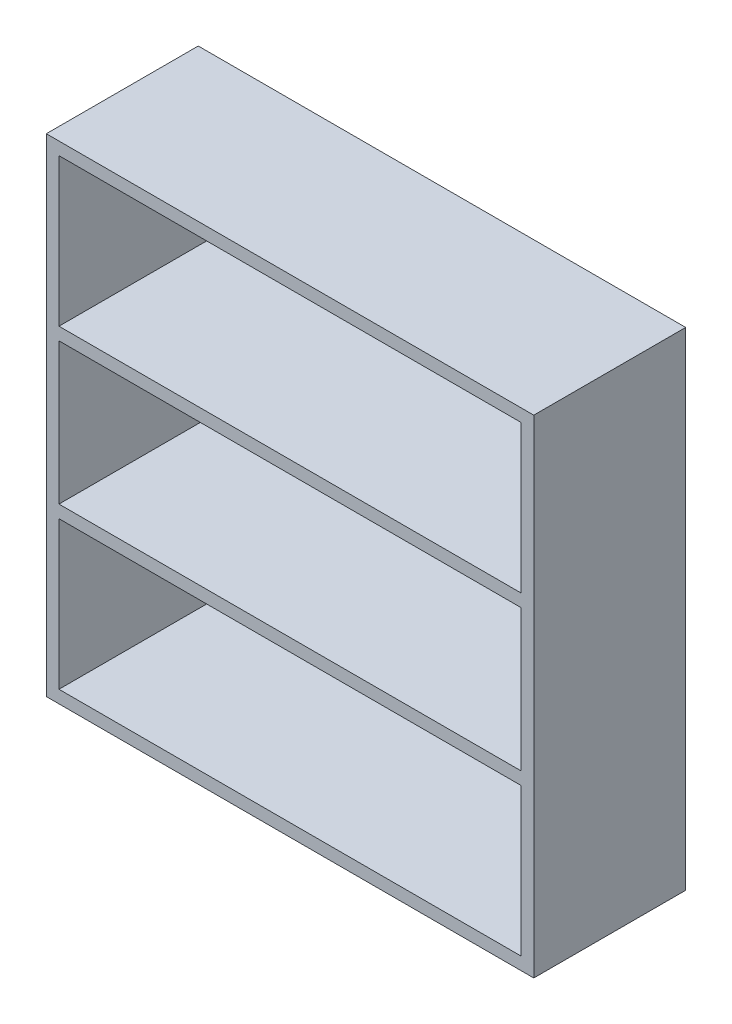
from build123d import *

# Parameters (mm, degrees)
SKETCH1_W           = 1955.8
SKETCH1_H           = 609.6
BOSS_EXTRUDE1_DEPTH = 1955.8
SKETCH2_W           = 1854.2
SKETCH2_H           = 592.666666667
SKETCH2_H_2         = 567.266666666
CUT_EXTRUDE1_DEPTH  = 2271.033966706


with BuildPart() as part:
    # Sketch1 → Boss-Extrude1 (new body)
    with BuildSketch(Plane(origin=(0, 0, 0), x_dir=(1, 0, 0), z_dir=(0, 1, 0))):
        Rectangle(SKETCH1_W, SKETCH1_H)
    extrude(amount=BOSS_EXTRUDE1_DEPTH)

    # Sketch2 → Cut-Extrude1 (cut, through all)
    with BuildSketch(Plane.XY.offset(304.8)):
        with Locations((0, 347.133333333)):
            Rectangle(SKETCH2_W, SKETCH2_H)
        with Locations((0, 1608.666666667)):
            Rectangle(SKETCH2_W, SKETCH2_H)
        with Locations((0, 977.9)):
            Rectangle(SKETCH2_W, SKETCH2_H_2)
    extrude(amount=-CUT_EXTRUDE1_DEPTH, mode=Mode.SUBTRACT)


solid = part.part
